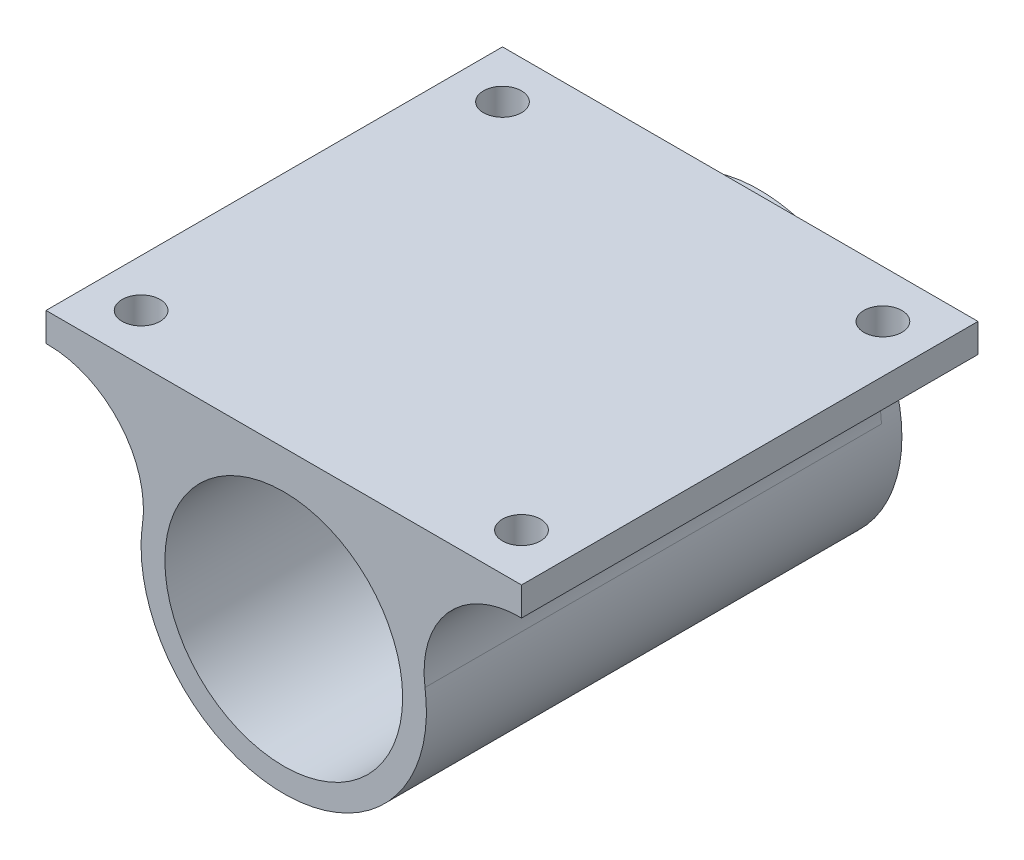
from build123d import *

# Parameters (mm, degrees)
SKETCH1_R           = 12.5
BOSS_EXTRUDE1_DEPTH = 48
BOSS_EXTRUDE3_START = 2
SKETCH3_R           = 15
SKETCH3_R_2         = 11
BOSS_EXTRUDE3_DEPTH = 2
SKETCH4_R           = 2
CUT_EXTRUDE1_DEPTH  = 63.623877738


with BuildPart() as part:
    # Sketch1 → Boss-Extrude1 (new body)
    with BuildSketch(Plane.XY):
        with BuildLine():
            Line((24.754908454, 13.492063492), (25, 13.492063492))
            Line((25, 13.492063492), (25, 16.507936508))
            Line((25, 16.507936508), (-25, 16.507936508))
            Line((-25, 16.507936508), (-25, 13.492063492))
            Line((-25, 13.492063492), (-24.754908454, 13.492063492))
            ThreePointArc((-24.754908454, 13.492063492), (-17.206125308, 10.050712211), (-14.852945072, 2.095238095))
            ThreePointArc((-14.852945072, 2.095238095), (0, -15), (14.852945072, 2.095238095))
            ThreePointArc((14.852945072, 2.095238095), (17.206125308, 10.050712211), (24.754908454, 13.492063492))
        make_face()
        Circle(SKETCH1_R, mode=Mode.SUBTRACT)
    extrude(amount=BOSS_EXTRUDE1_DEPTH)

    # Sketch3 → Boss-Extrude3 (add)
    with BuildSketch(Plane(origin=(0, 0, 0), x_dir=(-1, 0, 0), z_dir=(0, 0, -1)).offset(BOSS_EXTRUDE3_START)):
        Circle(SKETCH3_R)
        Circle(SKETCH3_R_2, mode=Mode.SUBTRACT)
    extrude(amount=-BOSS_EXTRUDE3_DEPTH)

    # Sketch4 → Cut-Extrude1 (cut, through all)
    with BuildSketch(Plane(origin=(0, 16.507936508, 0), x_dir=(1, 0, 0), z_dir=(0, 1, 0))):
        with Locations(Location((-20, -5, 0), (0, 0, 270))):
            Circle(SKETCH4_R)
        with Locations(Location((20, -5, 0), (0, 0, 270))):
            Circle(SKETCH4_R)
        with Locations(Location((20, -43, 0), (0, 0, 270))):
            Circle(SKETCH4_R)
        with Locations(Location((-20, -43, 0), (0, 0, 270))):
            Circle(SKETCH4_R)
    extrude(amount=-CUT_EXTRUDE1_DEPTH, mode=Mode.SUBTRACT)


solid = part.part
